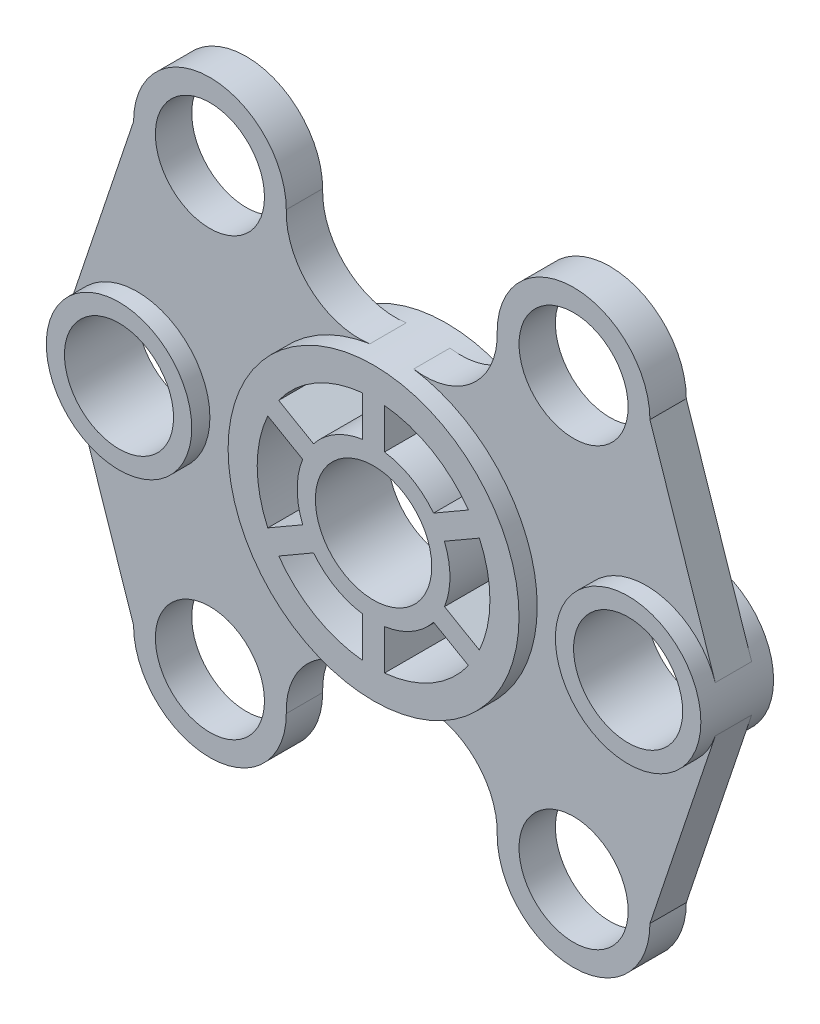
from build123d import *

# Parameters (mm, degrees)
SKETCH1_R             = 20
SKETCH1_R_2           = 15
BOSS_EXTRUDE1_DEPTH   = 10
SKETCH1_R_3           = 40
SKETCH1_R_4           = 16
BOSS_EXTRUDE1_2_DEPTH = 10
BOSS_EXTRUDE1_3_DEPTH = 10
SKETCH1_4_R           = 15
BOSS_EXTRUDE2_DEPTH   = 5


with BuildPart() as part:
    # Sketch1 → Boss-Extrude1 (new, symmetric)
    with BuildSketch(Plane.XY):
        with Locations((-70, 0)):
            Circle(SKETCH1_R)
        with Locations((-70, 0)):
            Circle(SKETCH1_R_2, mode=Mode.SUBTRACT)
    extrude(amount=BOSS_EXTRUDE1_DEPTH, both=True)



with BuildPart() as body_2:
    # Sketch1 → Boss-Extrude1 2 (new, symmetric)
    with BuildSketch(Plane.XY):
        Circle(SKETCH1_R_3)
        with BuildLine():
            ThreePointArc((-16.5, -12.990381057), (-10.5, -18.186533479), (-3, -20.784609691))
            Line((-3, -20.784609691), (-3, -31.859064644))
            ThreePointArc((-3, -31.859064644), (-16, -27.712812921), (-26.090759323, -18.527608533))
            Line((-26.090759323, -18.527608533), (-16.5, -12.990381057))
        make_face(mode=Mode.SUBTRACT)
        with BuildLine():
            ThreePointArc((-19.5, 7.794228634), (-21, 0), (-19.5, -7.794228634))
            Line((-19.5, -7.794228634), (-29.090759323, -13.331456111))
            ThreePointArc((-29.090759323, -13.331456111), (-32, 0), (-29.090759323, 13.331456111))
            Line((-29.090759323, 13.331456111), (-19.5, 7.794228634))
        make_face(mode=Mode.SUBTRACT)
        with BuildLine():
            ThreePointArc((3, -20.784609691), (10.5, -18.186533479), (16.5, -12.990381057))
            Line((16.5, -12.990381057), (26.090759323, -18.527608533))
            ThreePointArc((26.090759323, -18.527608533), (16, -27.712812921), (3, -31.859064644))
            Line((3, -31.859064644), (3, -20.784609691))
        make_face(mode=Mode.SUBTRACT)
        with BuildLine():
            Line((-3, 31.859064644), (-3, 20.784609691))
            ThreePointArc((-3, 20.784609691), (-10.5, 18.186533479), (-16.5, 12.990381057))
            Line((-16.5, 12.990381057), (-26.090759323, 18.527608533))
            ThreePointArc((-26.090759323, 18.527608533), (-16, 27.712812921), (-3, 31.859064644))
        make_face(mode=Mode.SUBTRACT)
        Circle(SKETCH1_R_4, mode=Mode.SUBTRACT)
        with BuildLine():
            ThreePointArc((19.5, -7.794228634), (21, 0), (19.5, 7.794228634))
            Line((19.5, 7.794228634), (29.090759323, 13.331456111))
            ThreePointArc((29.090759323, 13.331456111), (32, 0), (29.090759323, -13.331456111))
            Line((29.090759323, -13.331456111), (19.5, -7.794228634))
        make_face(mode=Mode.SUBTRACT)
        with BuildLine():
            ThreePointArc((16.5, 12.990381057), (10.5, 18.186533479), (3, 20.784609691))
            Line((3, 20.784609691), (3, 31.859064644))
            ThreePointArc((3, 31.859064644), (16, 27.712812921), (26.090759323, 18.527608533))
            Line((26.090759323, 18.527608533), (16.5, 12.990381057))
        make_face(mode=Mode.SUBTRACT)
    extrude(amount=BOSS_EXTRUDE1_2_DEPTH, both=True)


with BuildPart() as body_3:
    # Sketch1 → Boss-Extrude1 3 (new, symmetric)
    with BuildSketch(Plane.XY):
        with Locations((70, 0)):
            Circle(SKETCH1_R)
        with Locations((70, 0)):
            Circle(SKETCH1_R_2, mode=Mode.SUBTRACT)
    extrude(amount=BOSS_EXTRUDE1_3_DEPTH, both=True)


with BuildPart() as part_1:
    add(part.part)

    add(body_2.part)  # Boss-Extrude2 merges body 2

    add(body_3.part)  # Boss-Extrude2 merges body 3
    # Sketch1<4> → Boss-Extrude2 (add, symmetric)
    # profile 1 of 2: a face of its own
    with BuildSketch(Plane.XY):
        with BuildLine():
            Line((-88.964969944, -6.350583834), (-71, -60))
            ThreePointArc((-71, -60), (-50, -81), (-29, -60))
            ThreePointArc((-29, -60), (-22.304723723, -44.376428641), (-6.007722482, -39.546267467))
            ThreePointArc((-6.007722482, -39.546267467), (-40, 0), (-6.007722482, 39.546267467))
            ThreePointArc((-6.007722482, 39.546267467), (-22.304723723, 44.376428641), (-29, 60))
            ThreePointArc((-29, 60), (-50, 81), (-71, 60))
            Line((-71, 60), (-88.964969944, 6.350583834))
            ThreePointArc((-88.964969944, 6.350583834), (-50, 0), (-88.964969944, -6.350583834))
        make_face()
        with Locations((-50, -60)):
            Circle(SKETCH1_4_R, mode=Mode.SUBTRACT)
        with Locations((-50, 60)):
            Circle(SKETCH1_4_R, mode=Mode.SUBTRACT)
    # profile 2 of 2: a face of its own
    with BuildSketch(Plane.XY):
        with BuildLine():
            ThreePointArc((6.007722482, 39.546267467), (40, 0), (6.007722482, -39.546267467))
            ThreePointArc((6.007722482, -39.546267467), (22.304723723, -44.376428641), (29, -60))
            ThreePointArc((29, -60), (50, -81), (71, -60))
            Line((71, -60), (88.964969944, -6.350583834))
            ThreePointArc((88.964969944, -6.350583834), (50, 0), (88.964969944, 6.350583834))
            Line((88.964969944, 6.350583834), (71, 60))
            ThreePointArc((71, 60), (50, 81), (29, 60))
            ThreePointArc((29, 60), (22.304723723, 44.376428641), (6.007722482, 39.546267467))
        make_face()
        with Locations((50, -60)):
            Circle(SKETCH1_4_R, mode=Mode.SUBTRACT)
        with Locations((50, 60)):
            Circle(SKETCH1_4_R, mode=Mode.SUBTRACT)
    extrude(amount=BOSS_EXTRUDE2_DEPTH, both=True)


solid = part_1.part
